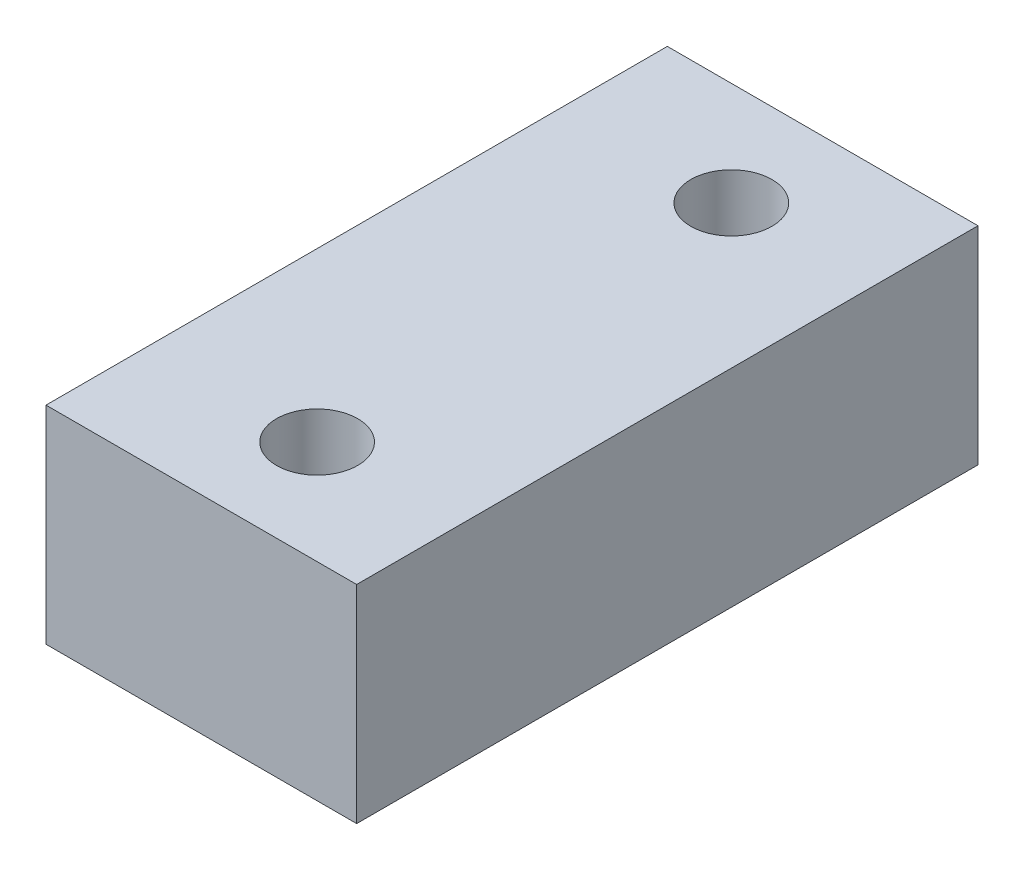
from build123d import *

# Parameters (mm, degrees)
BOSS_EXTRUDE1_DEPTH    = 12.7
F_10_CLEARANCE_HOLE1_D = 4.9784


with BuildPart() as part:
    # Sketch4 → Boss-Extrude1 (new body)
    with BuildSketch(Plane(origin=(0, 0, 0), x_dir=(1, 0, 0), z_dir=(0, 1, 0))):
        Polygon((-71.608792588, 6.232898137), (-71.608792588, 25.282898137), (-52.558792588, 25.282898137), (-52.558792588, -12.817101863), (-71.608792588, -12.817101863), align=None)
    extrude(amount=BOSS_EXTRUDE1_DEPTH)

    # #10 Clearance Hole1 (through all)
    with Locations(Plane(origin=(0, 12.7, 0), x_dir=(1, 0, 0), z_dir=(0, 1, 0))):
        with Locations((-61.333792588, 18.932898137), (-61.333792588, -6.467101863)):
            Hole(F_10_CLEARANCE_HOLE1_D / 2)


solid = part.part
